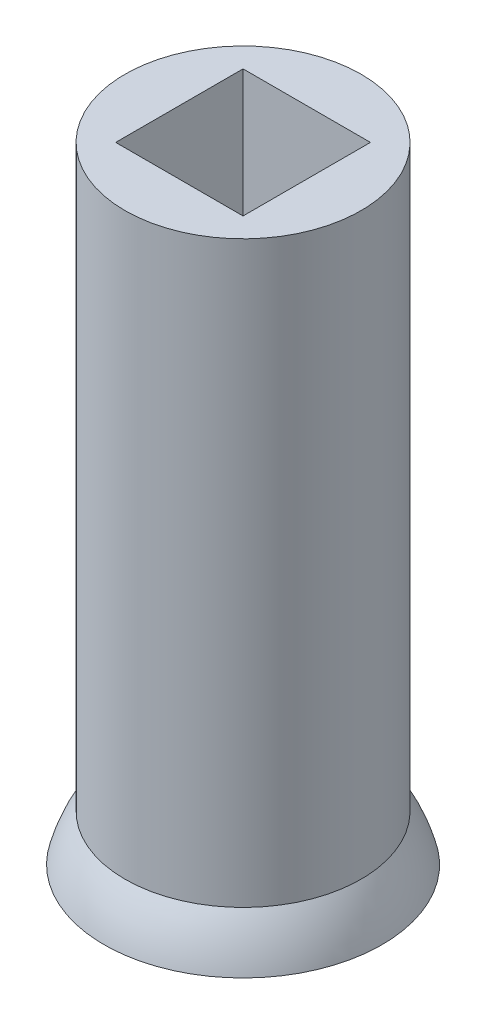
from build123d import *

# Parameters (mm, degrees)
SKETCH1_R           = 3.49
SKETCH1_W           = 2.98
SKETCH1_H           = 3.98
BOSS_EXTRUDE2_DEPTH = 7
SKETCH3_R           = 10.198039027
SKETCH3_W           = 11
SKETCH3_H           = 11
BOSS_EXTRUDE3_DEPTH = 50


with BuildPart() as part:
    # Sketch1 → Boss-Extrude2 (new body)
    with BuildSketch(Plane(origin=(0, 0, 0), x_dir=(1, 0, 0), z_dir=(0, 1, 0))):
        Circle(SKETCH1_R)
        Rectangle(SKETCH1_W, SKETCH1_H, mode=Mode.SUBTRACT)
    extrude(amount=BOSS_EXTRUDE2_DEPTH)

    # Sketch2 → Revolve1 (revolve)
    with BuildSketch(Plane(origin=(0, 0, 0), x_dir=(0, 0, -1), z_dir=(1, 0, 0))):
        with BuildLine():
            Line((10, 3), (12, 3))
            ThreePointArc((12, 3), (11.277776118, 5.080528106), (10.198039027, 7))
            Line((10.198039027, 7), (3.49, 7))
            Line((3.49, 7), (3.49, 6))
            Line((3.49, 6), (8.544003745, 6))
            ThreePointArc((8.544003745, 6), (9.392551236, 4.558506474), (10, 3))
        make_face()
    revolve(axis=Axis((0, 0.002779656, 0), (0, 1, 0)))

    # Sketch3 → Boss-Extrude3 (add)
    with BuildSketch(Plane(origin=(0, 7, 0), x_dir=(1, 0, 0), z_dir=(0, 1, 0))):
        Circle(SKETCH3_R)
        Rectangle(SKETCH3_W, SKETCH3_H, mode=Mode.SUBTRACT)
    extrude(amount=BOSS_EXTRUDE3_DEPTH)


solid = part.part
